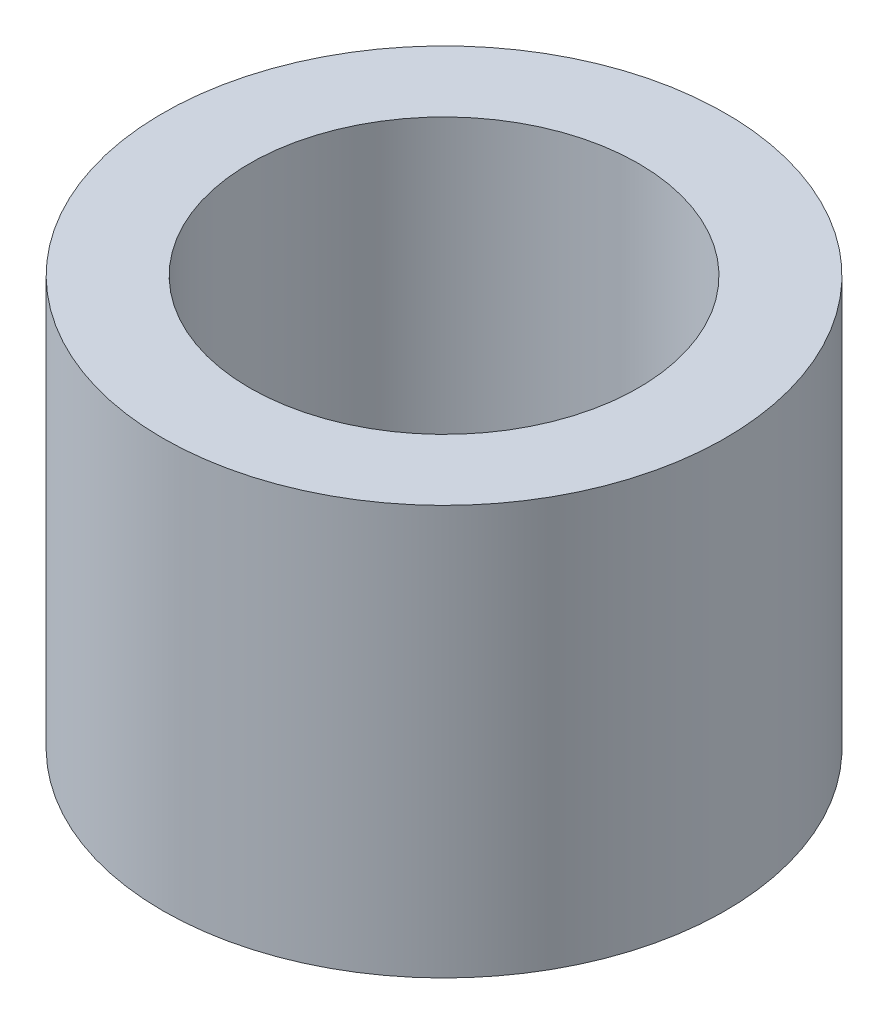
from build123d import *

# Parameters (mm, degrees)
SKETCH1_R           = 2.75
SKETCH1_R_2         = 1.9
BOSS_EXTRUDE1_DEPTH = 4


with BuildPart() as part:
    # Sketch1 → Boss-Extrude1 (new body)
    with BuildSketch(Plane(origin=(0, 0, 0), x_dir=(1, 0, 0), z_dir=(0, 1, 0))):
        with Locations(Location((0, 0, 0), (0, 0, 270))):
            Circle(SKETCH1_R)
        with Locations(Location((0, 0, 0), (0, 0, 270))):
            Circle(SKETCH1_R_2, mode=Mode.SUBTRACT)
    extrude(amount=BOSS_EXTRUDE1_DEPTH)


solid = part.part
